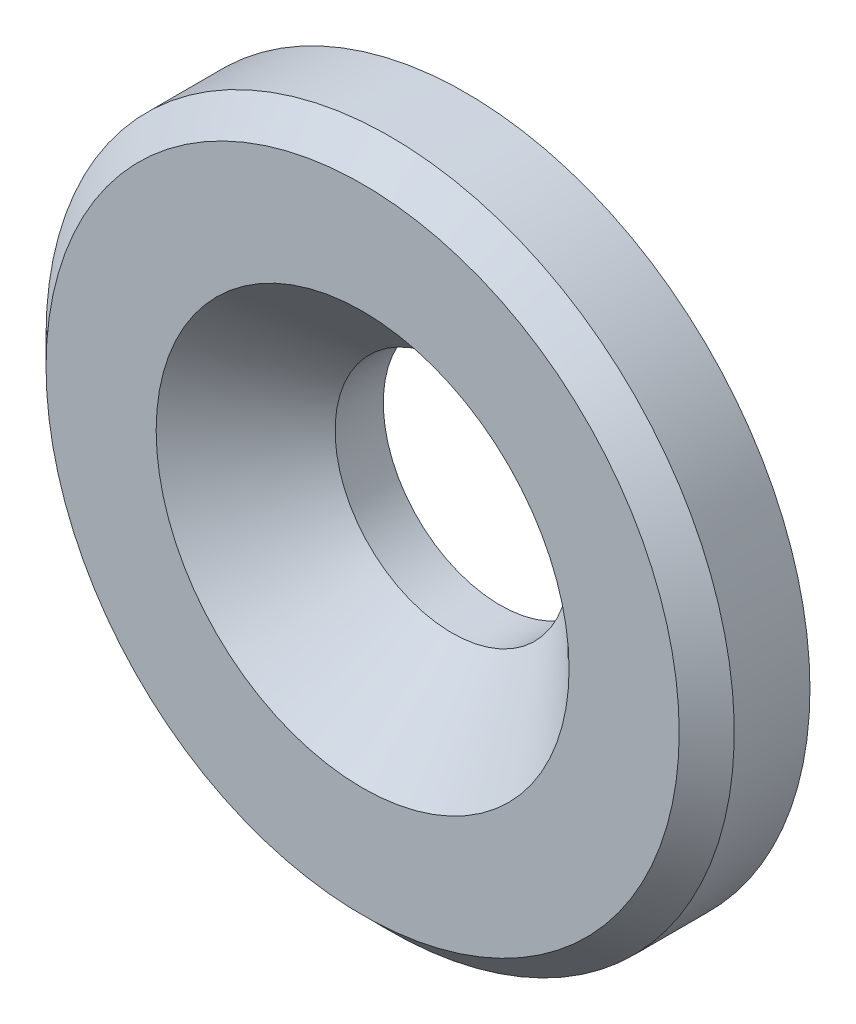
from build123d import *

# Parameters (mm, degrees)
SKETCH2_R           = 3.5
BOSS_EXTRUDE1_DEPTH = 0.5
SKETCH3_R           = 5
BOSS_EXTRUDE2_DEPTH = 1.5
CHAMFER1_SIZE       = 0.4


with BuildPart() as part:
    # Sketch2 → Boss-Extrude1 (new body)
    with BuildSketch(Plane.XY):
        Circle(SKETCH2_R)
    extrude(amount=BOSS_EXTRUDE1_DEPTH)

    # Sketch3 → Boss-Extrude2 (add)
    with BuildSketch(Plane.XY.offset(0.5)):
        Circle(SKETCH3_R)
    extrude(amount=BOSS_EXTRUDE2_DEPTH)

    # Chamfer1
    chamfer1_edges = [part.edges().sort_by_distance(p)[0] for p in [
        (-5, 0, 2),
    ]]
    chamfer(chamfer1_edges, length=CHAMFER1_SIZE)

    # Sketch4 → Cut-Revolve1 (revolve, cut)
    with BuildSketch(Plane(origin=(0, 0, 0), x_dir=(0, -1, 0), z_dir=(1, 0, 0)), mode=Mode.PRIVATE) as cut_revolve1_sk:
        Polygon((3, -2), (0, -2), (0, 0), (1.7, 0), (1.7, -0.7), align=None)
    revolve(cut_revolve1_sk.sketch.rotate(Axis((0, 0, 2), (0, 0, -1)), 90), axis=Axis((0, 0, 2), (0, 0, -1)), mode=Mode.SUBTRACT)


solid = part.part
